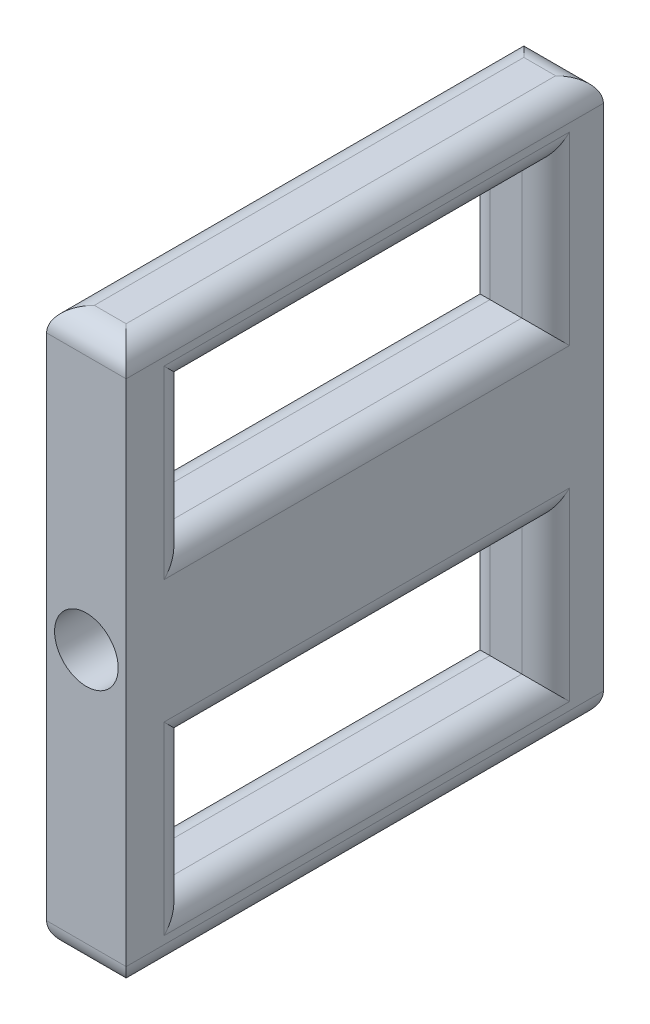
from build123d import *

# Parameters (mm, degrees)
SKETCH_1_W          = 10
SKETCH_1_H          = 70
SKETCH_1_R          = 4
EXTRUDE_1_DEPTH     = 60
SKETCH_2_W          = 44.992308415
SKETCH_2_H          = 17.259344539
CUT_EXTRUDE_1_DEPTH = 76.392930627
FILLET_1_R          = 3


with BuildPart() as part:
    # 草图1 → 凸台-拉伸1 (new body)
    with BuildSketch(Plane.XY):
        with Locations((5, -9.543169943)):
            Rectangle(SKETCH_1_W, SKETCH_1_H)
        with Locations((5, -9.543169943)):
            Circle(SKETCH_1_R, mode=Mode.SUBTRACT)
    extrude(amount=EXTRUDE_1_DEPTH)

    # 草图2 → 切除-拉伸1 (cut, through all)
    with BuildSketch(Plane(origin=(10, 0, 0), x_dir=(0, 0, -1), z_dir=(1, 0, 0))):
        with Locations((-29.753893106, -28.924255962)):
            Rectangle(SKETCH_2_W, SKETCH_2_H)
        with Locations((-29.753893106, 9.837916076)):
            Rectangle(SKETCH_2_W, SKETCH_2_H)
    extrude(amount=-CUT_EXTRUDE_1_DEPTH, mode=Mode.SUBTRACT)

    # 圆角1
    fillet_1_edges = [part.edges().sort_by_distance(p)[0] for p in [
        (5, -44.543169943, 60),
        (10, -28.924255962, 52.250047313),
        (10, -20.294583692, 29.753893106),
        (0, -28.924255962, 7.257738898),
        (0, -37.553928231, 29.753893106),
        (0, -28.924255962, 52.250047313),
        (0, -20.294583692, 29.753893106),
        (10, -37.553928231, 29.753893106),
        (10, -28.924255962, 7.257738898),
        (10, 18.467588345, 29.753893106),
        (10, 9.837916075, 7.257738898),
        (0, 1.208243806, 29.753893106),
        (0, 9.837916075, 52.250047313),
        (0, 18.467588345, 29.753893106),
        (0, 9.837916075, 7.257738898),
        (10, 9.837916075, 52.250047313),
        (10, 1.208243806, 29.753893106),
        (5, 25.456830057, 60),
        (5, -44.543169943, 0),
        (5, 25.456830057, 0),
        (10, 25.456830057, 30),
        (10, -44.543169943, 30),
        (0, -44.543169943, 30),
        (0, 25.456830057, 30),
    ]]
    fillet(fillet_1_edges, radius=FILLET_1_R)


solid = part.part
